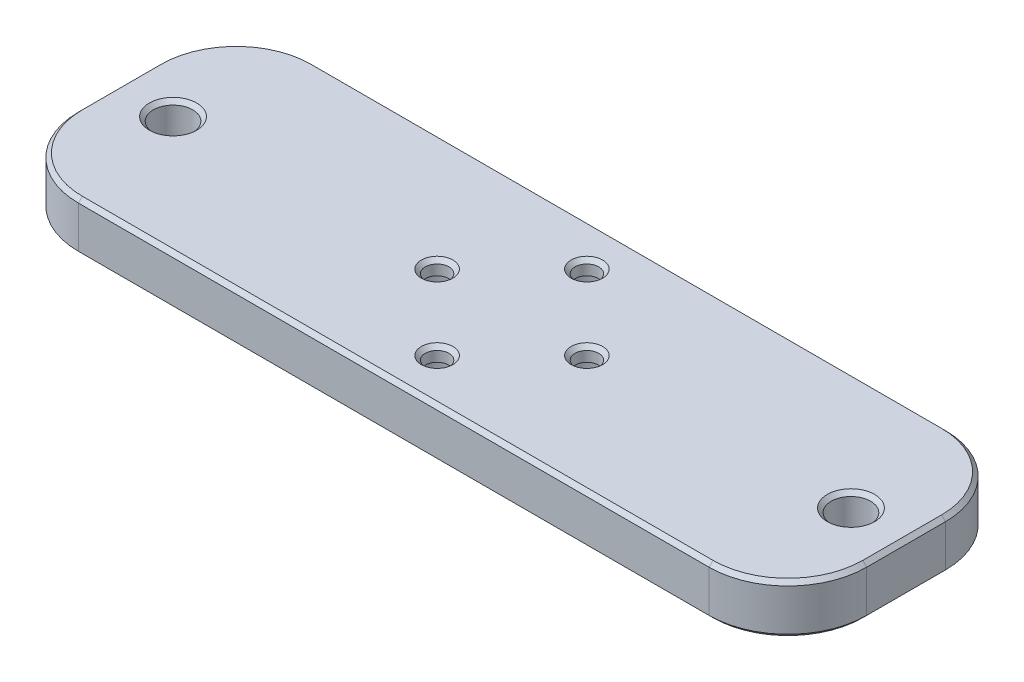
from build123d import *

# Parameters (mm, degrees)
SKETCH1_R           = 2.5
SKETCH1_R_2         = 1.5
BOSS_EXTRUDE1_DEPTH = 6.3
SKETCH2_R           = 3.25
CUT_EXTRUDE1_DEPTH  = 4.5
CHAMFER1_SIZE       = 0.5


with BuildPart() as part:
    # Sketch1 → Boss-Extrude1 (new body)
    with BuildSketch(Plane(origin=(0, 0, 0), x_dir=(1, 0, 0), z_dir=(0, 1, 0))):
        with BuildLine():
            Line((40, 15), (-40, 15))
            ThreePointArc((-40, 15), (-47.071067812, 12.071067812), (-50, 5))
            Line((-50, 5), (-50, -5))
            ThreePointArc((-50, -5), (-47.071067812, -12.071067812), (-40, -15))
            Line((-40, -15), (40, -15))
            ThreePointArc((40, -15), (47.071067812, -12.071067812), (50, -5))
            Line((50, -5), (50, 5))
            ThreePointArc((50, 5), (47.071067812, 12.071067812), (40, 15))
        make_face()
        with Locations(Location((43, 0, 0), (0, 0, 270))):
            Circle(SKETCH1_R, mode=Mode.SUBTRACT)
        with Locations(Location((-43, 0, 0), (0, 0, 90))):
            Circle(SKETCH1_R, mode=Mode.SUBTRACT)
        with Locations(Location((0, -9.5, 0), (0, 0, 270))):
            Circle(SKETCH1_R_2, mode=Mode.SUBTRACT)
        with Locations(Location((-9.5, 0, 0), (0, 0, 270))):
            Circle(SKETCH1_R_2, mode=Mode.SUBTRACT)
        with Locations(Location((0, 9.5, 0), (0, 0, 270))):
            Circle(SKETCH1_R_2, mode=Mode.SUBTRACT)
        with Locations(Location((9.5, 0, 0), (0, 0, 270))):
            Circle(SKETCH1_R_2, mode=Mode.SUBTRACT)
    extrude(amount=BOSS_EXTRUDE1_DEPTH)

    # Sketch2 → Cut-Extrude1 (cut)
    with BuildSketch(Plane.XZ):
        with Locations(Location((0, 9.5, 0), (0, 0, 270))):
            Circle(SKETCH2_R)
        with Locations(Location((9.5, 0, 0), (0, 0, 270))):
            Circle(SKETCH2_R)
        with Locations(Location((0, -9.5, 0), (0, 0, 270))):
            Circle(SKETCH2_R)
        with Locations(Location((-9.5, 0, 0), (0, 0, 270))):
            Circle(SKETCH2_R)
    extrude(amount=-CUT_EXTRUDE1_DEPTH, mode=Mode.SUBTRACT)

    # Chamfer1
    chamfer1_edges = [part.edges().sort_by_distance(p)[0] for p in [
        (0, 0, 15),
        (-47.071067812, 0, 12.071067812),
        (-50, 0, 0),
        (-47.071067812, 0, -12.071067812),
        (-47.071067812, 6.3, 12.071067812),
        (0, 6.3, 15),
        (47.071067812, 6.3, 12.071067812),
        (43, 0, -2.5),
        (43, 6.3, -2.5),
        (50, 6.3, 0),
        (-43, 0, 2.5),
        (-43, 6.3, 2.5),
        (47.071067812, 6.3, -12.071067812),
        (0, 6.3, 8),
        (0, 6.3, -15),
        (-9.5, 6.3, -1.5),
        (0, 6.3, -11),
        (9.5, 6.3, -1.5),
        (-47.071067812, 6.3, -12.071067812),
        (0, 0, 12.75),
        (9.5, 0, 3.25),
        (0, 0, -6.25),
        (-9.5, 0, 3.25),
        (0, 0, -15),
        (-50, 6.3, 0),
        (47.071067812, 0, -12.071067812),
        (50, 0, 0),
        (47.071067812, 0, 12.071067812),
    ]]
    chamfer(chamfer1_edges, length=CHAMFER1_SIZE)


solid = part.part
